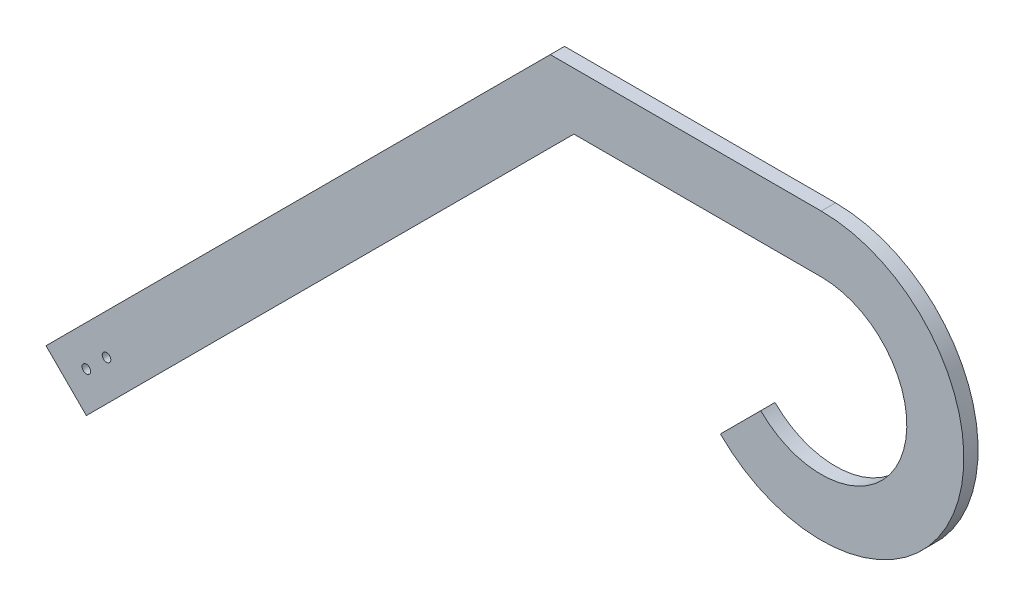
from build123d import *

# Parameters (mm, degrees)
EXTRUDE_1_DEPTH     = 5
SKETCH_2_R          = 1.5
CUT_EXTRUDE_1_DEPTH = 307.179177957


with BuildPart() as part:
    # 草图1 → 凸台-拉伸1 (new body)
    with BuildSketch(Plane.XY):
        with BuildLine():
            Line((0, 50), (-95, 50))
            Line((-95, 50), (-271.776695297, -126.776695297))
            Line((-271.776695297, -126.776695297), (-257.634559673, -140.91883092))
            Line((-257.634559673, -140.91883092), (-86.715728753, 30))
            Line((-86.715728753, 30), (0, 30))
            ThreePointArc((0, 30), (27.716385975, -11.480502971), (-21.213203436, -21.213203436))
            Line((-21.213203436, -21.213203436), (-35.355339059, -35.355339059))
            ThreePointArc((-35.355339059, -35.355339059), (46.193976626, -19.134171618), (0, 50))
        make_face()
    extrude(amount=EXTRUDE_1_DEPTH)

    # 草图2 → 切除-拉伸1 (cut, through all)
    with BuildSketch(Plane.XY.offset(5)):
        with Locations((-257.634559673, -126.776695297)):
            Circle(SKETCH_2_R)
        with Locations((-250.563491861, -119.705627485)):
            Circle(SKETCH_2_R)
    extrude(amount=-CUT_EXTRUDE_1_DEPTH, mode=Mode.SUBTRACT)


solid = part.part
